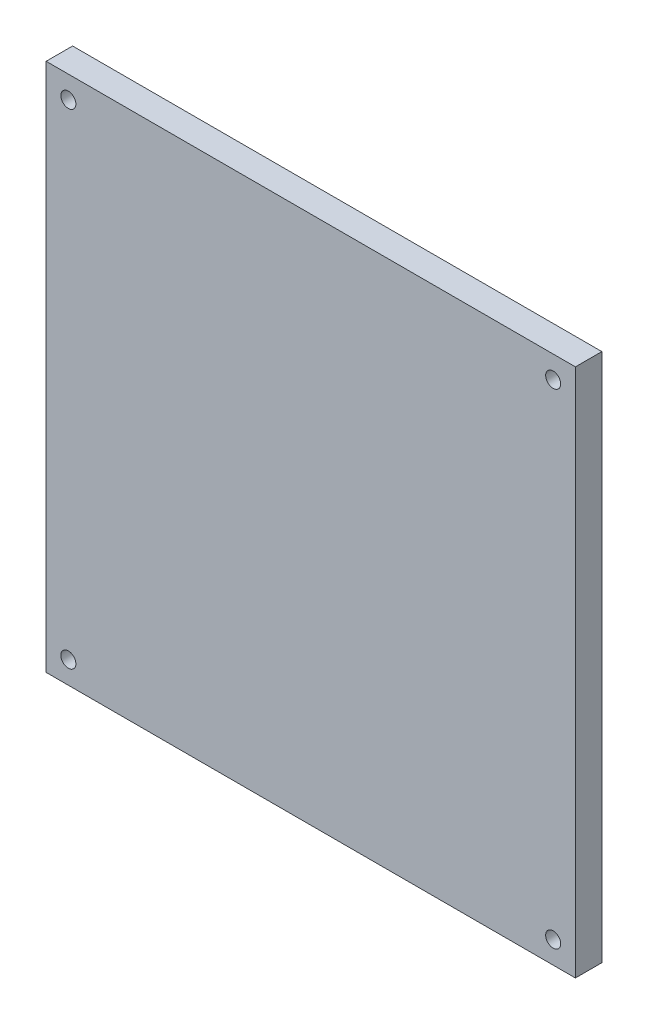
from build123d import *

# Parameters (mm, degrees)
ESQUISSE2_W             = 100
ESQUISSE2_H             = 100
BOSS_EXTRU_1_DEPTH      = 5
ESQUISSE3_R             = 1.42
ENL_V_MAT_EXTRU_1_DEPTH = 5


with BuildPart() as part:
    # Esquisse2 → Boss.-Extru.1 (new body)
    with BuildSketch(Plane.XY):
        Rectangle(ESQUISSE2_W, ESQUISSE2_H)
    extrude(amount=BOSS_EXTRU_1_DEPTH)

    # Esquisse3 → Enlèv. mat.-Extru.1 (cut)
    with BuildSketch(Plane.XY.offset(5)):
        with Locations((-45.8, 45.8)):
            Circle(ESQUISSE3_R)
        with Locations((-45.8, -45.8)):
            Circle(ESQUISSE3_R)
        with Locations((45.8, -45.8)):
            Circle(ESQUISSE3_R)
        with Locations((45.8, 45.8)):
            Circle(ESQUISSE3_R)
    extrude(amount=-ENL_V_MAT_EXTRU_1_DEPTH, mode=Mode.SUBTRACT)


solid = part.part
